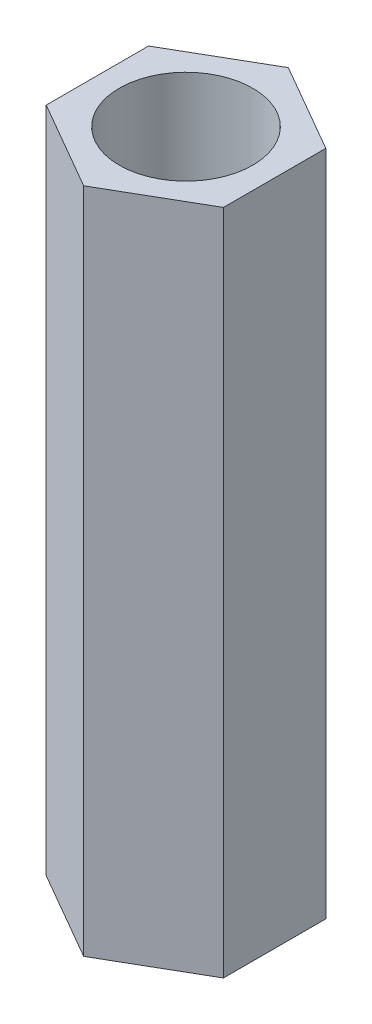
from build123d import *

# Parameters (mm, degrees)
SKETCH_1_R      = 1.5
EXTRUDE_1_DEPTH = 15


with BuildPart() as part:
    # 草图1 → 凸台-拉伸1 (new body)
    with BuildSketch(Plane(origin=(0, 0, 0), x_dir=(1, 0, 0), z_dir=(0, 1, 0))):
        Polygon((1.991858429, 1.15), (0, 2.3), (-1.991858429, 1.15), (-1.991858429, -1.15), (0, -2.3), (1.991858429, -1.15), align=None)
        with Locations(Location((0, 0, 0), (0, 0, 270))):
            Circle(SKETCH_1_R, mode=Mode.SUBTRACT)
    extrude(amount=EXTRUDE_1_DEPTH)


solid = part.part
